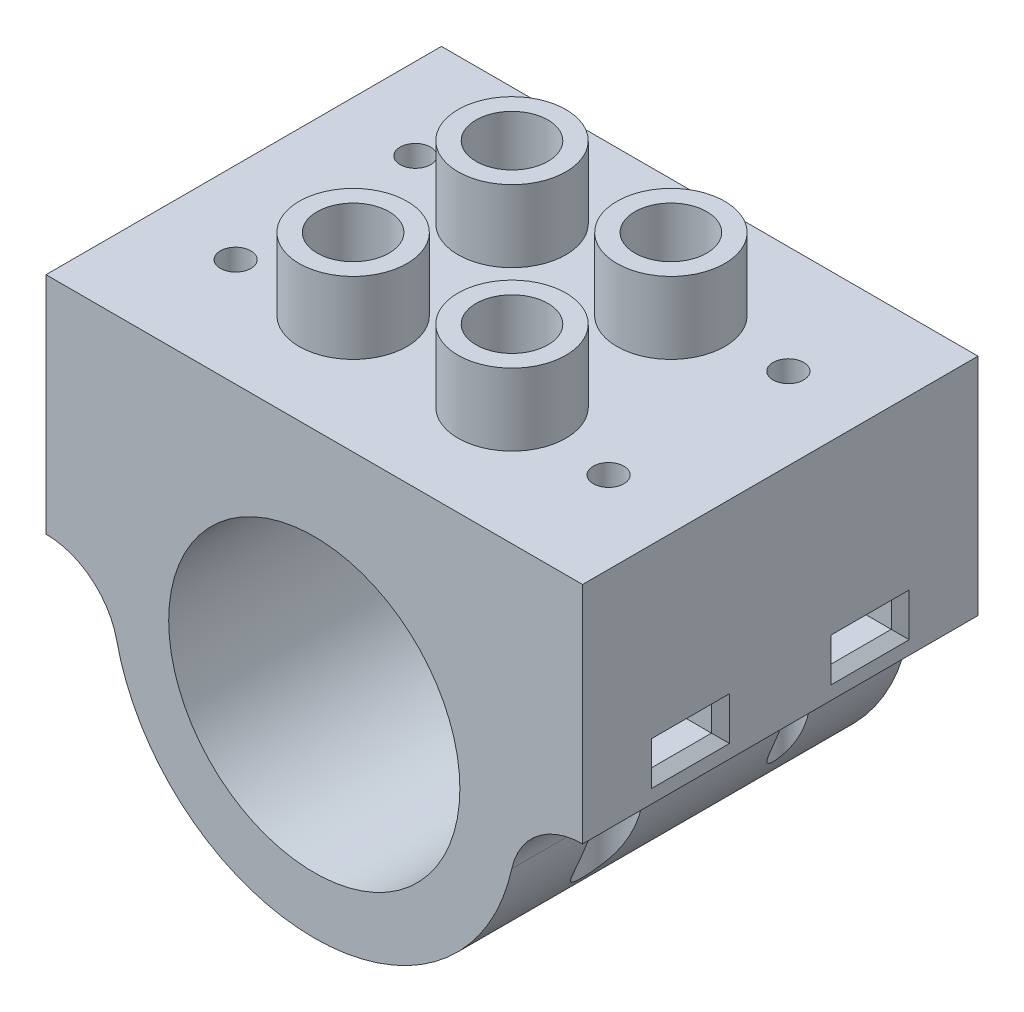
from build123d import *

# Parameters (mm, degrees)
BOSS_EXTRUDE1_DEPTH            = 44
SKETCH2_R                      = 16.2
CUT_EXTRUDE1_DEPTH             = 35
CUT_EXTRUDE2_REACH             = 61.408
SKETCH3_R                      = 9.7
CBORE_FOR_M3_SHCS1_D           = 3.4
CBORE_FOR_M3_SHCS1_CBORE_D     = 6.5
CBORE_FOR_M3_SHCS1_CBORE_DEPTH = 3
CUT_EXTRUDE3_REACH             = 74.305
SKETCH6_R                      = 1.7
CUT_EXTRUDE4_DEPTH             = 2.8
CHAMFER1_SIZE                  = 1
SKETCH8_R                      = 3
CUT_EXTRUDE5_DEPTH             = 12.5
SKETCH9_R                      = 4
CUT_EXTRUDE6_DEPTH             = 9
BOSS_EXTRUDE2_START            = 8
SKETCH10_R                     = 6
SKETCH10_R_2                   = 4
BOSS_EXTRUDE2_DEPTH            = 8
SKETCH11_R                     = 2.275
CUT_EXTRUDE7_DEPTH             = 8
CHAMFER2_SIZE                  = 0.75


with BuildPart() as part:
    # Sketch1 → Boss-Extrude1 (new body)
    with BuildSketch(Plane.XY):
        with BuildLine():
            Line((-29.85, 26.5), (-29.85, 1.5))
            ThreePointArc((-29.85, 1.5), (-24.797715119, -0.27918943), (-21.975123081, -4.831559332))
            ThreePointArc((-21.975123081, -4.831559332), (0, -22.5), (21.975123081, -4.831559332))
            ThreePointArc((21.975123081, -4.831559332), (24.797715119, -0.27918943), (29.85, 1.5))
            Line((29.85, 1.5), (29.85, 26.5))
            Line((29.85, 26.5), (-29.85, 26.5))
        make_face()
    extrude(amount=BOSS_EXTRUDE1_DEPTH)

    # Sketch2 → Cut-Extrude1 (cut)
    with BuildSketch(Plane.XY.offset(44)):
        Circle(SKETCH2_R)
    extrude(amount=-CUT_EXTRUDE1_DEPTH, mode=Mode.SUBTRACT)

    # Sketch3 → Cut-Extrude2 (cut, up to next)
    with BuildSketch(Plane(origin=(0, 0, 0), x_dir=(-1, 0, 0), z_dir=(0, 0, -1)), mode=Mode.PRIVATE) as cut_extrude2_sk1:
        Circle(SKETCH3_R)
    cut_extrude2_tool1 = extrude(cut_extrude2_sk1.sketch, amount=-CUT_EXTRUDE2_REACH, mode=Mode.PRIVATE) & part.part
    add(cut_extrude2_tool1.solids().sort_by_distance((0, 0, 0))[0], mode=Mode.SUBTRACT)

    # CBORE for M3 SHCS1 (through all)
    with Locations(Plane(origin=(0, 0, 0), x_dir=(-1, 0, 0), z_dir=(0, 0, -1))):
        with Locations((-12.21600407, -4.446261863), (-4.446261863, 12.21600407), (12.21600407, 4.446261863), (4.446261863, -12.21600407)):
            CounterBoreHole(CBORE_FOR_M3_SHCS1_D / 2, CBORE_FOR_M3_SHCS1_CBORE_D / 2, CBORE_FOR_M3_SHCS1_CBORE_DEPTH)

    # Sketch6 → Cut-Extrude3 (cut, up to next)
    with BuildSketch(Plane(origin=(0, 26.5, 0), x_dir=(1, 0, 0), z_dir=(0, 1, 0)), mode=Mode.PRIVATE) as cut_extrude3_sk1:
        with Locations(Location((20.75, -12, 0), (0, 0, 270))):
            Circle(SKETCH6_R)
    cut_extrude3_tool1 = extrude(cut_extrude3_sk1.sketch, amount=-CUT_EXTRUDE3_REACH, mode=Mode.PRIVATE) & part.part
    # Sketch6 → Cut-Extrude3 (cut, up to next)
    with BuildSketch(Plane(origin=(0, 26.5, 0), x_dir=(1, 0, 0), z_dir=(0, 1, 0)), mode=Mode.PRIVATE) as cut_extrude3_sk2:
        with Locations(Location((20.75, -32, 0), (0, 0, 316.109050722))):
            Circle(SKETCH6_R)
    cut_extrude3_tool2 = extrude(cut_extrude3_sk2.sketch, amount=-CUT_EXTRUDE3_REACH, mode=Mode.PRIVATE) & part.part
    # Sketch6 → Cut-Extrude3 (cut, up to next)
    with BuildSketch(Plane(origin=(0, 26.5, 0), x_dir=(1, 0, 0), z_dir=(0, 1, 0)), mode=Mode.PRIVATE) as cut_extrude3_sk3:
        with Locations(Location((-20.75, -12, 0), (0, 0, 223.890949278))):
            Circle(SKETCH6_R)
    cut_extrude3_tool3 = extrude(cut_extrude3_sk3.sketch, amount=-CUT_EXTRUDE3_REACH, mode=Mode.PRIVATE) & part.part
    # Sketch6 → Cut-Extrude3 (cut, up to next)
    with BuildSketch(Plane(origin=(0, 26.5, 0), x_dir=(1, 0, 0), z_dir=(0, 1, 0)), mode=Mode.PRIVATE) as cut_extrude3_sk4:
        with Locations(Location((-20.75, -32, 0), (0, 0, 270))):
            Circle(SKETCH6_R)
    cut_extrude3_tool4 = extrude(cut_extrude3_sk4.sketch, amount=-CUT_EXTRUDE3_REACH, mode=Mode.PRIVATE) & part.part
    add(cut_extrude3_tool1.solids().sort_by_distance((20.75, 26.5, 12))[0], mode=Mode.SUBTRACT)
    add(cut_extrude3_tool2.solids().sort_by_distance((20.75, 26.5, 32))[0], mode=Mode.SUBTRACT)
    add(cut_extrude3_tool3.solids().sort_by_distance((-20.75, 26.5, 12))[0], mode=Mode.SUBTRACT)
    add(cut_extrude3_tool4.solids().sort_by_distance((-20.75, 26.5, 32))[0], mode=Mode.SUBTRACT)

    # Sketch7 → Cut-Extrude4 (cut)
    with BuildSketch(Plane(origin=(0, 4, 0), x_dir=(-1, 0, 0), z_dir=(0, -1, 0))):
        Polygon((-23.65, -10.325684219), (-20.75, -8.651368439), (-29.85, -8.651368439), (-29.85, -15.348631561), (-20.75, -15.348631561), (-23.65, -13.674315781), align=None)
        Polygon((-29.85, -28.651368439), (-20.75, -28.651368439), (-23.65, -30.325684219), (-23.65, -33.674315781), (-20.75, -35.348631561), (-29.85, -35.348631561), align=None)
        Polygon((-23.65, -30.325684219), (-23.65, -33.674315781), (-20.75, -35.348631561), (-17.85, -33.674315781), (-17.85, -30.325684219), (-20.75, -28.651368439), align=None)
        Polygon((-20.75, -8.651368439), (-17.85, -10.325684219), (-17.85, -13.674315781), (-20.75, -15.348631561), (-23.65, -13.674315781), (-23.65, -10.325684219), align=None)
        Polygon((29.85, -15.348631561), (20.75, -15.348631561), (23.65, -13.674315781), (23.65, -10.325684219), (20.75, -8.651368439), (29.85, -8.651368439), align=None)
        Polygon((23.65, -13.674315781), (23.65, -10.325684219), (20.75, -8.651368439), (17.85, -10.325684219), (17.85, -13.674315781), (20.75, -15.348631561), align=None)
        Polygon((23.65, -33.674315781), (20.75, -35.348631561), (29.85, -35.348631561), (29.85, -28.651368439), (20.75, -28.651368439), (23.65, -30.325684219), align=None)
        Polygon((20.75, -35.348631561), (17.85, -33.674315781), (17.85, -30.325684219), (20.75, -28.651368439), (23.65, -30.325684219), (23.65, -33.674315781), align=None)
    extrude(amount=-CUT_EXTRUDE4_DEPTH, mode=Mode.SUBTRACT)

    # Chamfer1
    chamfer1_edges = [part.edges().sort_by_distance(p)[0] for p in [
        (-29.85, 4, 32),
        (-29.85, 6.8, 32),
        (-29.85, 5.4, 28.651368439),
        (-29.85, 5.4, 35.348631561),
        (-29.85, 6.8, 12),
        (-29.85, 4, 12),
        (-29.85, 5.4, 8.651368439),
        (-29.85, 5.4, 15.348631561),
        (29.85, 4, 12),
        (29.85, 6.8, 12),
        (29.85, 5.4, 15.348631561),
        (29.85, 5.4, 8.651368439),
        (29.85, 6.8, 32),
        (29.85, 4, 32),
        (29.85, 5.4, 35.348631561),
        (29.85, 5.4, 28.651368439),
    ]]
    chamfer(chamfer1_edges, length=CHAMFER1_SIZE)

    # Sketch8 → Cut-Extrude5 (cut)
    with BuildSketch(Plane(origin=(0, -18.5, 0), x_dir=(-1, 0, 0), z_dir=(0, -1, 0))):
        with Locations((20.75, -32)):
            Circle(SKETCH8_R)
        with Locations((-20.75, -32)):
            Circle(SKETCH8_R)
    extrude(amount=-CUT_EXTRUDE5_DEPTH, mode=Mode.SUBTRACT)

    # Sketch9 → Cut-Extrude6 (cut)
    with BuildSketch(Plane(origin=(0, 26.5, 0), x_dir=(1, 0, 0), z_dir=(0, 1, 0))):
        with Locations(Location((8.838834765, -13.161165235, 0), (0, 0, 270))):
            Circle(SKETCH9_R)
        with Locations(Location((8.838834765, -30.838834765, 0), (0, 0, 270))):
            Circle(SKETCH9_R)
        with Locations(Location((-8.838834765, -30.838834765, 0), (0, 0, 270))):
            Circle(SKETCH9_R)
        with Locations(Location((-8.838834765, -13.161165235, 0), (0, 0, 270))):
            Circle(SKETCH9_R)
    extrude(amount=-CUT_EXTRUDE6_DEPTH, mode=Mode.SUBTRACT)

    # Sketch10 → Boss-Extrude2 (add)
    # profile 1 of 4: a face of its own
    with BuildSketch(Plane(origin=(0, 26.5, 0), x_dir=(1, 0, 0), z_dir=(0, 1, 0)).offset(BOSS_EXTRUDE2_START)):
        with Locations(Location((8.838834765, -13.161165235, 0), (0, 0, 270))):
            Circle(SKETCH10_R)
        with Locations(Location((8.838834765, -13.161165235, 0), (0, 0, 270))):
            Circle(SKETCH10_R_2, mode=Mode.SUBTRACT)
    # profile 2 of 4: a face of its own
    with BuildSketch(Plane(origin=(0, 26.5, 0), x_dir=(1, 0, 0), z_dir=(0, 1, 0)).offset(BOSS_EXTRUDE2_START)):
        with Locations(Location((8.838834765, -30.838834765, 0), (0, 0, 270))):
            Circle(SKETCH10_R)
        with Locations(Location((8.838834765, -30.838834765, 0), (0, 0, 270))):
            Circle(SKETCH10_R_2, mode=Mode.SUBTRACT)
    # profile 3 of 4: a face of its own
    with BuildSketch(Plane(origin=(0, 26.5, 0), x_dir=(1, 0, 0), z_dir=(0, 1, 0)).offset(BOSS_EXTRUDE2_START)):
        with Locations(Location((-8.838834765, -30.838834765, 0), (0, 0, 270))):
            Circle(SKETCH10_R)
        with Locations(Location((-8.838834765, -30.838834765, 0), (0, 0, 270))):
            Circle(SKETCH10_R_2, mode=Mode.SUBTRACT)
    # profile 4 of 4: a face of its own
    with BuildSketch(Plane(origin=(0, 26.5, 0), x_dir=(1, 0, 0), z_dir=(0, 1, 0)).offset(BOSS_EXTRUDE2_START)):
        with Locations(Location((-8.838834765, -13.161165235, 0), (0, 0, 270))):
            Circle(SKETCH10_R)
        with Locations(Location((-8.838834765, -13.161165235, 0), (0, 0, 270))):
            Circle(SKETCH10_R_2, mode=Mode.SUBTRACT)
    extrude(amount=-BOSS_EXTRUDE2_DEPTH)

    # Sketch11 → Cut-Extrude7 (cut)
    with BuildSketch(Plane.ZY.offset(29.85)):
        with Locations((22, 10)):
            Circle(SKETCH11_R)
        with Locations((22, 18)):
            Circle(SKETCH11_R)
    extrude(amount=-CUT_EXTRUDE7_DEPTH, mode=Mode.SUBTRACT)

    # Chamfer2
    chamfer2_edges = [part.edges().sort_by_distance(p)[0] for p in [
        (-29.85, 10, 19.725),
        (-29.85, 18, 19.725),
    ]]
    chamfer(chamfer2_edges, length=CHAMFER2_SIZE)


solid = part.part
